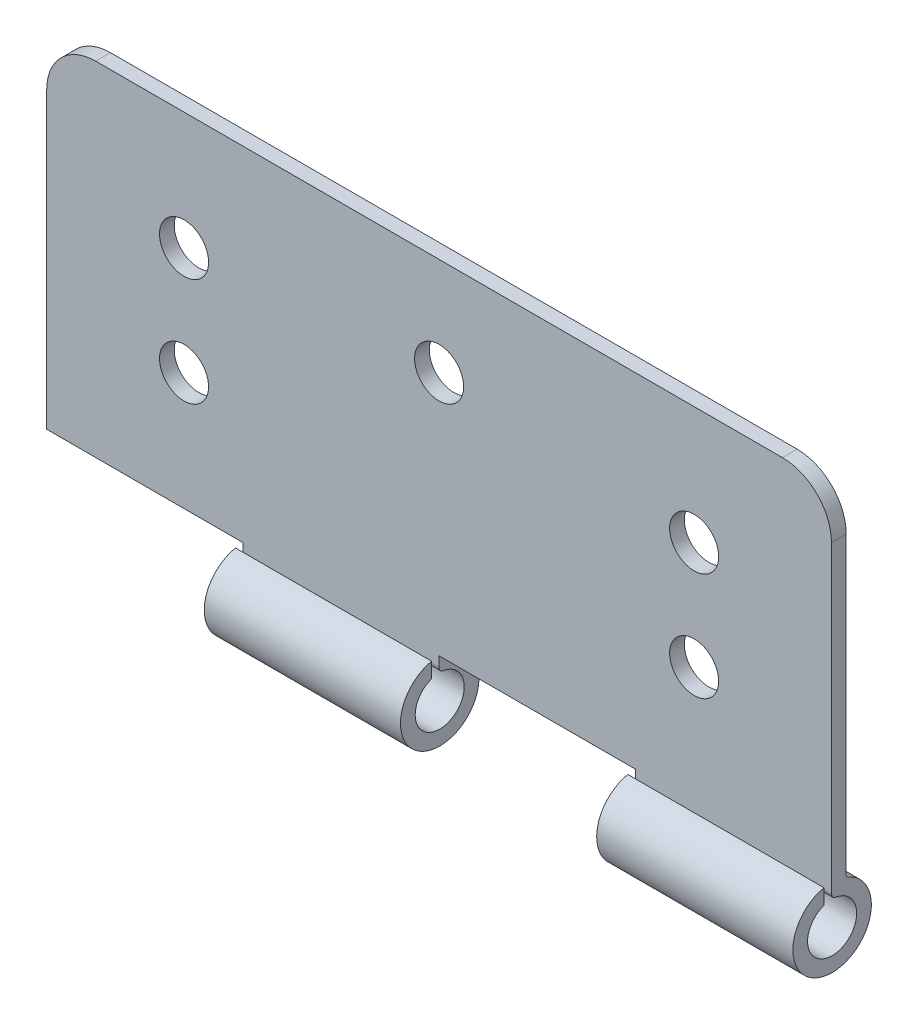
from build123d import *

# Parameters (mm, degrees)
BOSS_EXTRUDE1_DEPTH = 1.5
BOSS_EXTRUDE3_DEPTH = 20
LPATTERN1_COUNT     = 2
LPATTERN1_PITCH     = 40
SKETCH7_R           = 2.5
CUT_EXTRUDE1_DEPTH  = 48.610167833
SKETCH8_R           = 2.5
CUT_EXTRUDE2_DEPTH  = 48.610167833


with BuildPart() as part:
    # Sketch2 → Boss-Extrude1 (new body)
    with BuildSketch(Plane.XY):
        with BuildLine():
            Line((40, -17.5), (-40, -17.5))
            Line((-40, -17.5), (-40, 12.5))
            ThreePointArc((-40, 12.5), (-38.535533906, 16.035533906), (-35, 17.5))
            Line((-35, 17.5), (35, 17.5))
            ThreePointArc((35, 17.5), (38.535533906, 16.035533906), (40, 12.5))
            Line((40, 12.5), (40, -17.5))
        make_face()
    extrude(amount=BOSS_EXTRUDE1_DEPTH)

    # Sketch6 → Boss-Extrude3 (add)
    with BuildSketch(Plane(origin=(40, 0, 0), x_dir=(0, 0, -1), z_dir=(1, 0, 0))):
        with BuildLine():
            Line((-2.264835489, -17.585982761), (-2.264835489, -19.140334974))
            ThreePointArc((-2.264835489, -19.140334974), (-1.199434521, -23.988140772), (-1.072937624, -19.026256169))
            ThreePointArc((-1.072937624, -19.026256169), (-1.378463216, -18.858354721), (-1.5, -18.531604672))
            Line((-1.5, -18.531604672), (-1.5, -17.5))
            Line((-1.5, -17.5), (0, -17.5))
            Line((0, -17.5), (0, -17.598947109))
            ThreePointArc((0, -17.598947109), (0.041052608, -17.736209584), (0.150727898, -17.8283922))
            ThreePointArc((0.150727898, -17.8283922), (-1.837032289, -25.479523), (-2.264835489, -17.585982761))
        make_face()
    boss_extrude3 = extrude(amount=-BOSS_EXTRUDE3_DEPTH)

    # LPattern1: Boss-Extrude3 ×2
    with Locations(*[(-i * LPATTERN1_PITCH, 0, 0) for i in range(1, LPATTERN1_COUNT)]):
        add(boss_extrude3)

    # Sketch7 → Cut-Extrude1 (cut, through all)
    with BuildSketch(Plane.XY.offset(1.5)):
        with Locations((0, 7.5)):
            Circle(SKETCH7_R)
        with Locations((-26, -5.5)):
            Circle(SKETCH7_R)
        with Locations((26, -5.5)):
            Circle(SKETCH7_R)
    extrude(amount=-CUT_EXTRUDE1_DEPTH, mode=Mode.SUBTRACT)

    # Sketch8 → Cut-Extrude2 (cut, through all)
    with BuildSketch(Plane.XY.offset(1.5)):
        with Locations((-26, 5.5)):
            Circle(SKETCH8_R)
        with Locations((26, 5.5)):
            Circle(SKETCH8_R)
    extrude(amount=-CUT_EXTRUDE2_DEPTH, mode=Mode.SUBTRACT)


solid = part.part
